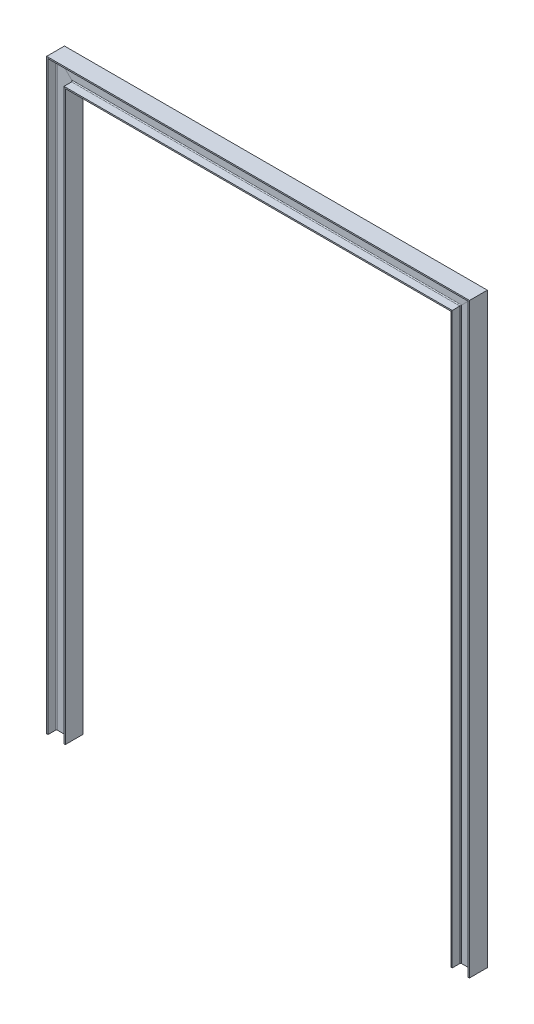
from build123d import *

# Parameters (mm, degrees)
W_SECTION_W12X96_1_DEPTH   = 10224.3935776
W_SECTION_W12X96_1_2_DEPTH = 7448.7871552
W_SECTION_W12X96_1_3_DEPTH = 10224.393577601


with BuildPart() as part:
    # Sketch13 → W section W12X96(1) (new body)
    with BuildSketch(Plane.ZX):
        with BuildLine():
            Line((-154.432, -161.417), (-154.432, -138.557))
            Line((-154.432, -138.557), (-22.225, -138.557))
            ThreePointArc((-22.225, -138.557), (-11.448692655, -134.093307345), (-6.985, -123.317))
            Line((-6.985, -123.317), (-6.985, 123.317))
            ThreePointArc((-6.985, 123.317), (-11.448692655, 134.093307345), (-22.225, 138.557))
            Line((-22.225, 138.557), (-154.432, 138.557))
            Line((-154.432, 138.557), (-154.432, 161.417))
            Line((-154.432, 161.417), (154.432, 161.417))
            Line((154.432, 161.417), (154.432, 138.557))
            Line((154.432, 138.557), (22.225, 138.557))
            ThreePointArc((22.225, 138.557), (11.448692655, 134.093307345), (6.985, 123.317))
            Line((6.985, 123.317), (6.985, -123.317))
            ThreePointArc((6.985, -123.317), (11.448692655, -134.093307345), (22.225, -138.557))
            Line((22.225, -138.557), (154.432, -138.557))
            Line((154.432, -138.557), (154.432, -161.417))
            Line((154.432, -161.417), (-154.432, -161.417))
        make_face()
    extrude(amount=W_SECTION_W12X96_1_DEPTH)

    # W section W12X96(1) mitre 1
    split(bisect_by=Plane(origin=(0, 10000, 0), x_dir=(0.707106781, -0.707106781, 0), z_dir=(-0.707106781, -0.707106781, 0)), keep=Keep.TOP)


with BuildPart() as body_2:
    # Sketch13 on segment 2 (carried to segment 2) → W section W12X96_1 2 (new body)
    with BuildSketch(Plane(origin=(-224.3935776, 10000, 0), x_dir=(0, 0, 1), z_dir=(1, 0, 0))):
        with BuildLine():
            Line((-154.432, -161.417), (-154.432, -138.557))
            Line((-154.432, -138.557), (-22.225, -138.557))
            ThreePointArc((-22.225, -138.557), (-11.448692655, -134.093307345), (-6.985, -123.317))
            Line((-6.985, -123.317), (-6.985, 123.317))
            ThreePointArc((-6.985, 123.317), (-11.448692655, 134.093307345), (-22.225, 138.557))
            Line((-22.225, 138.557), (-154.432, 138.557))
            Line((-154.432, 138.557), (-154.432, 161.417))
            Line((-154.432, 161.417), (154.432, 161.417))
            Line((154.432, 161.417), (154.432, 138.557))
            Line((154.432, 138.557), (22.225, 138.557))
            ThreePointArc((22.225, 138.557), (11.448692655, 134.093307345), (6.985, 123.317))
            Line((6.985, 123.317), (6.985, -123.317))
            ThreePointArc((6.985, -123.317), (11.448692655, -134.093307345), (22.225, -138.557))
            Line((22.225, -138.557), (154.432, -138.557))
            Line((154.432, -138.557), (154.432, -161.417))
            Line((154.432, -161.417), (-154.432, -161.417))
        make_face()
    extrude(amount=W_SECTION_W12X96_1_2_DEPTH)

    # W section W12X96_1 2 mitre 1
    split(bisect_by=Plane(origin=(0, 10000, 0), x_dir=(-0.707106781, 0.707106781, 0), z_dir=(0.707106781, 0.707106781, 0)), keep=Keep.TOP)

    # W section W12X96_1 2 mitre 2
    split(bisect_by=Plane(origin=(7000, 10000, 0), x_dir=(-0.707106781, -0.707106781, 0), z_dir=(-0.707106781, 0.707106781, 0)), keep=Keep.TOP)


with BuildPart() as body_3:
    # Sketch13 on segment 3 (carried to segment 3) → W section W12X96_1 3 (new body)
    with BuildSketch(Plane(origin=(7000, 10224.3935776, 0), x_dir=(0, 0, 1), z_dir=(0, -1, 0))):
        with BuildLine():
            Line((-154.432, -161.417), (-154.432, -138.557))
            Line((-154.432, -138.557), (-22.225, -138.557))
            ThreePointArc((-22.225, -138.557), (-11.448692655, -134.093307345), (-6.985, -123.317))
            Line((-6.985, -123.317), (-6.985, 123.317))
            ThreePointArc((-6.985, 123.317), (-11.448692655, 134.093307345), (-22.225, 138.557))
            Line((-22.225, 138.557), (-154.432, 138.557))
            Line((-154.432, 138.557), (-154.432, 161.417))
            Line((-154.432, 161.417), (154.432, 161.417))
            Line((154.432, 161.417), (154.432, 138.557))
            Line((154.432, 138.557), (22.225, 138.557))
            ThreePointArc((22.225, 138.557), (11.448692655, 134.093307345), (6.985, 123.317))
            Line((6.985, 123.317), (6.985, -123.317))
            ThreePointArc((6.985, -123.317), (11.448692655, -134.093307345), (22.225, -138.557))
            Line((22.225, -138.557), (154.432, -138.557))
            Line((154.432, -138.557), (154.432, -161.417))
            Line((154.432, -161.417), (-154.432, -161.417))
        make_face()
    extrude(amount=W_SECTION_W12X96_1_3_DEPTH)

    # W section W12X96_1 3 mitre 1
    split(bisect_by=Plane(origin=(7000, 10000, 0), x_dir=(0.707106781, 0.707106781, 0), z_dir=(0.707106781, -0.707106781, 0)), keep=Keep.TOP)


solid = Compound([part.part, body_2.part, body_3.part])
